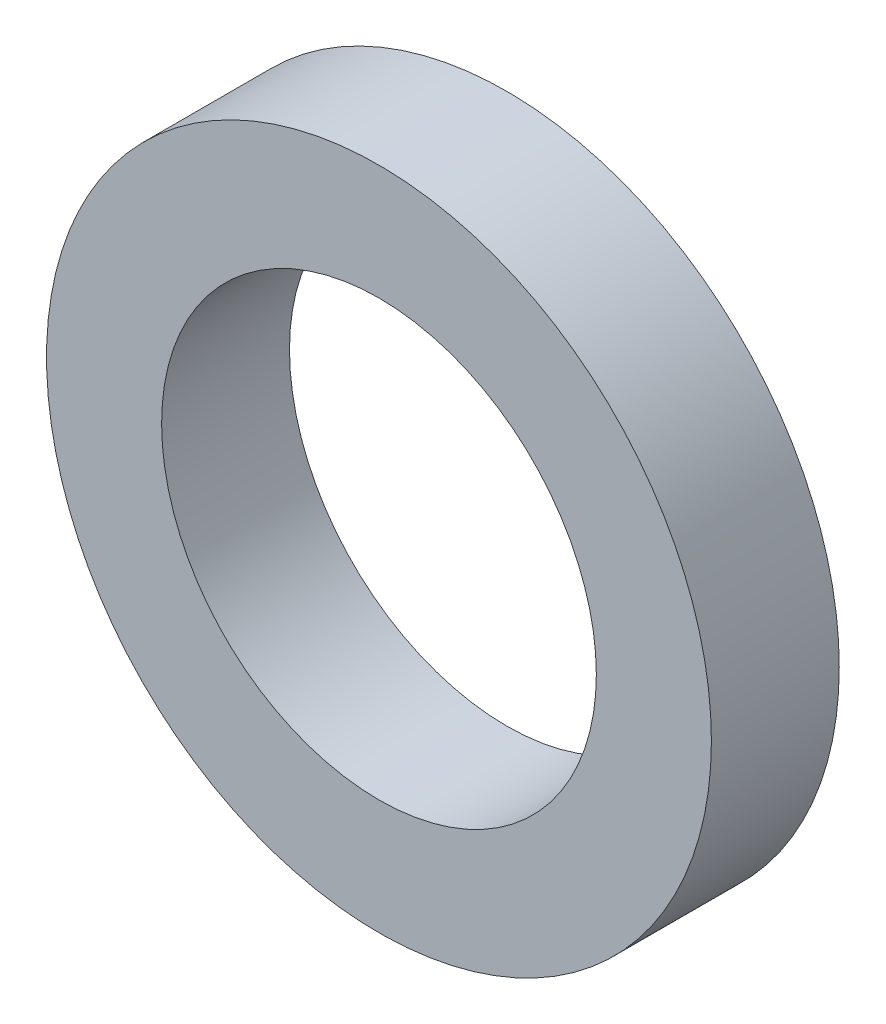
from build123d import *

# Parameters (mm, degrees)
BEARING6803_START = -15
SKETCH_1_R        = 13
SKETCH_1_R_2      = 8.5
BEARING6803_DEPTH = 5


with BuildPart() as part:
    # Эскиз1 → Bearing6803 (new body)
    with BuildSketch(Plane.XY.offset(BEARING6803_START)):
        Circle(SKETCH_1_R)
        Circle(SKETCH_1_R_2, mode=Mode.SUBTRACT)
    extrude(amount=BEARING6803_DEPTH)


solid = part.part
